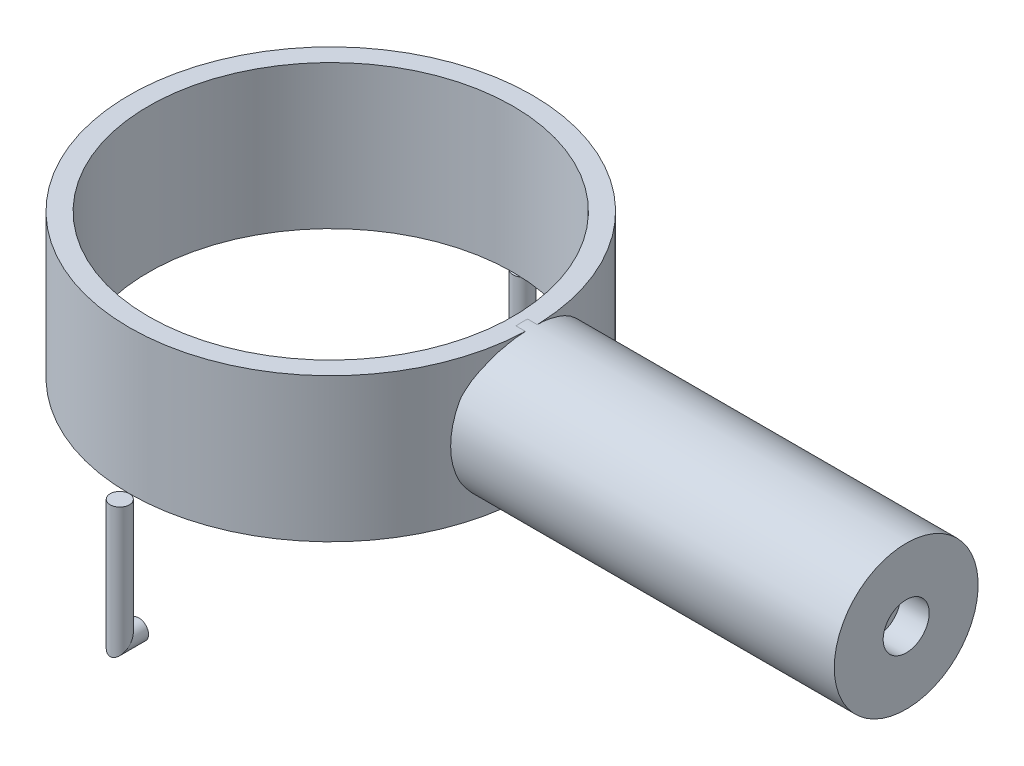
from build123d import *

# Parameters (mm, degrees)
SKETCH1_R           = 21
SKETCH1_R_2         = 19
BOSS_EXTRUDE1_DEPTH = 15
SKETCH2_R           = 7.5
BOSS_EXTRUDE2_DEPTH = 40
SKETCH3_R           = 2.4
CUT_EXTRUDE1_DEPTH  = 3
SWEEP4_PROFILE_R    = 1
SWEEP5_PROFILE_R    = 1


with BuildPart() as part:
    # Sketch1 → Boss-Extrude1 (new body)
    with BuildSketch(Plane(origin=(0, 0, 0), x_dir=(1, 0, 0), z_dir=(0, 1, 0))):
        with Locations(Location((0, 0, 0), (0, 0, 270))):
            Circle(SKETCH1_R)
        with Locations(Location((0, 0, 0), (0, 0, 270))):
            Circle(SKETCH1_R_2, mode=Mode.SUBTRACT)
    extrude(amount=BOSS_EXTRUDE1_DEPTH)


with BuildPart() as body_2:
    # Sketch2 → Boss-Extrude2 (new body)
    with BuildSketch(Plane(origin=(20, 0, 0), x_dir=(0, 0, -1), z_dir=(1, 0, 0))):
        with Locations(Location((0, 7.532005334, 0), (0, 0, 180))):
            Circle(SKETCH2_R)
    extrude(amount=BOSS_EXTRUDE2_DEPTH)

    # Sketch3 → Cut-Extrude1 (cut)
    with BuildSketch(Plane(origin=(60, 0, 0), x_dir=(0, 0, -1), z_dir=(1, 0, 0))):
        with Locations((0, 7.532005334)):
            Circle(SKETCH3_R)
    extrude(amount=-CUT_EXTRUDE1_DEPTH, mode=Mode.SUBTRACT)


with BuildPart() as body_3:
    # Sweep4: sweep along a path in Sketch5
    with BuildLine(Plane(origin=(0, 0, 0), x_dir=(0, 0, -1), z_dir=(1, 0, 0))) as sweep4_path:
        Line((-22, 0), (-22, -12.716489415))
        Line((-22, -12.716489415), (-20, -12.716489415))
    # Sweep4 profile (on start of the path) → Sweep4 (sweep)
    with BuildSketch(Plane(origin=(0, 0, 22), x_dir=(0, 0, -1), z_dir=(0, -1, 0))):
        Circle(SWEEP4_PROFILE_R)
    sweep(path=sweep4_path.line, transition=Transition.RIGHT)


with BuildPart() as body_4:
    # Sweep5: sweep along a path in Sketch89
    with BuildLine(Plane(origin=(0, 0, 0), x_dir=(0, 0, -1), z_dir=(1, 0, 0))) as sweep5_path:
        Line((20, -0.234854142), (20, -12.951343557))
        Line((20, -12.951343557), (18, -12.951343557))
    # Sweep5 profile (on start of the path) → Sweep5 (sweep)
    with BuildSketch(Plane(origin=(0, -0.234854142, -20), x_dir=(0, 0, -1), z_dir=(0, -1, 0))):
        Circle(SWEEP5_PROFILE_R)
    sweep(path=sweep5_path.line, transition=Transition.RIGHT)


solid = Compound([part.part, body_2.part, body_3.part, body_4.part])
